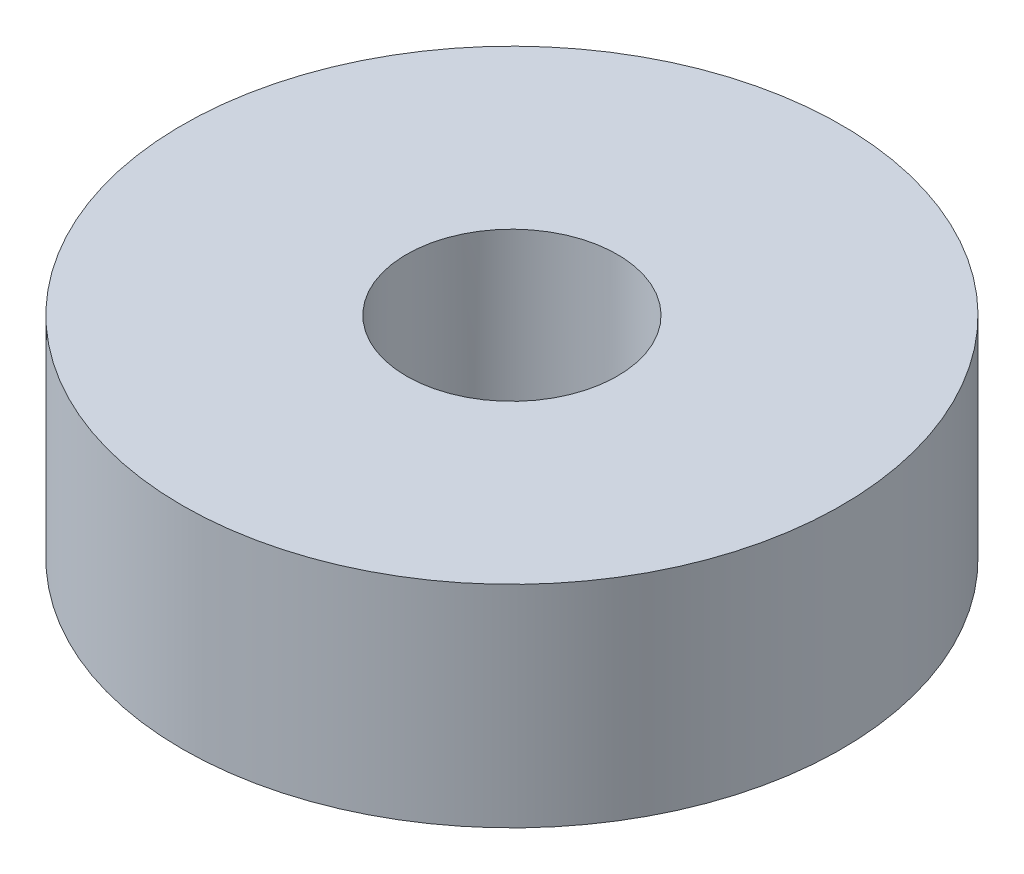
from build123d import *

# Parameters (mm, degrees)
BOSS_EXTRUDE1_DEPTH      = 6
BOSS_EXTRUDE1_DEPTH_BACK = 2
SKETCH1_R                = 12.5
SKETCH1_R_2              = 4
CUT_EXTRUDE1_DEPTH       = 2


with BuildPart() as part:
    # Sketch1 → Boss-Extrude1 (new, two sides: drawn at the far end of the back side and taken through both)
    with BuildSketch(Plane(origin=(0, 0, 0), x_dir=(1, 0, 0), z_dir=(0, 1, 0)).offset(-BOSS_EXTRUDE1_DEPTH_BACK)):
        with Locations(Location((0, 0, 0), (0, 0, 270))):
            Circle(SKETCH1_R)
        with Locations(Location((0, 0, 0), (0, 0, 270))):
            Circle(SKETCH1_R_2, mode=Mode.SUBTRACT)
    extrude(amount=BOSS_EXTRUDE1_DEPTH + BOSS_EXTRUDE1_DEPTH_BACK)

    # Sketch2 → Cut-Extrude1 (cut)
    with BuildSketch(Plane.XZ.offset(2)):
        Polygon((9.85829335, 0), (4.929146675, 8.537532479), (-4.929146675, 8.537532479), (-9.85829335, 0), (-4.929146675, -8.537532479), (4.929146675, -8.537532479), align=None)
    extrude(amount=-CUT_EXTRUDE1_DEPTH, mode=Mode.SUBTRACT)


solid = part.part
